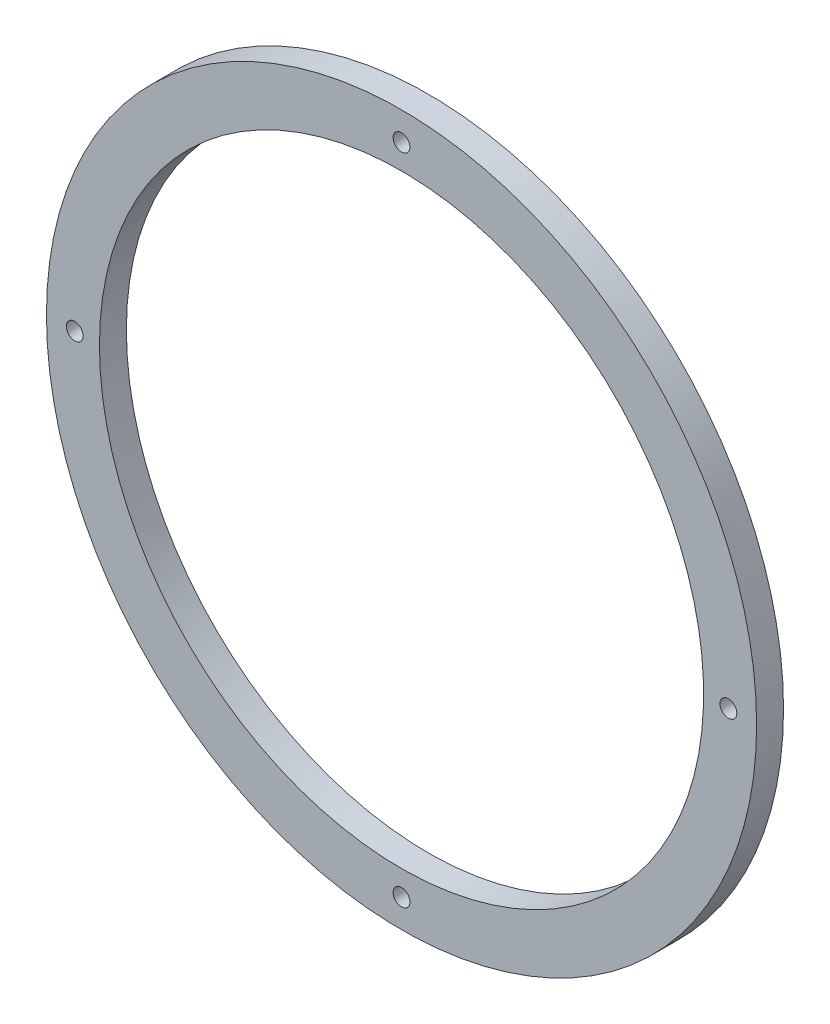
from build123d import *

# Parameters (mm, degrees)
SKETCH1_R           = 100.5
SKETCH1_R_2         = 85.5
SKETCH1_R_3         = 2.38125
BOSS_EXTRUDE1_DEPTH = 7.62


with BuildPart() as part:
    # Sketch1 → Boss-Extrude1 (new body)
    with BuildSketch(Plane.XY):
        with Locations(Location((0, 0, 0), (0, 0, 180))):
            Circle(SKETCH1_R)
        with Locations(Location((0, 0, 0), (0, 0, 180))):
            Circle(SKETCH1_R_2, mode=Mode.SUBTRACT)
        with Locations(Location((0, 92.5, 0), (0, 0, 180))):
            Circle(SKETCH1_R_3, mode=Mode.SUBTRACT)
        with Locations(Location((92.5, 0, 0), (0, 0, 180))):
            Circle(SKETCH1_R_3, mode=Mode.SUBTRACT)
        with Locations(Location((0, -92.5, 0), (0, 0, 180))):
            Circle(SKETCH1_R_3, mode=Mode.SUBTRACT)
        with Locations(Location((-92.5, 0, 0), (0, 0, 180))):
            Circle(SKETCH1_R_3, mode=Mode.SUBTRACT)
    extrude(amount=BOSS_EXTRUDE1_DEPTH)


solid = part.part
